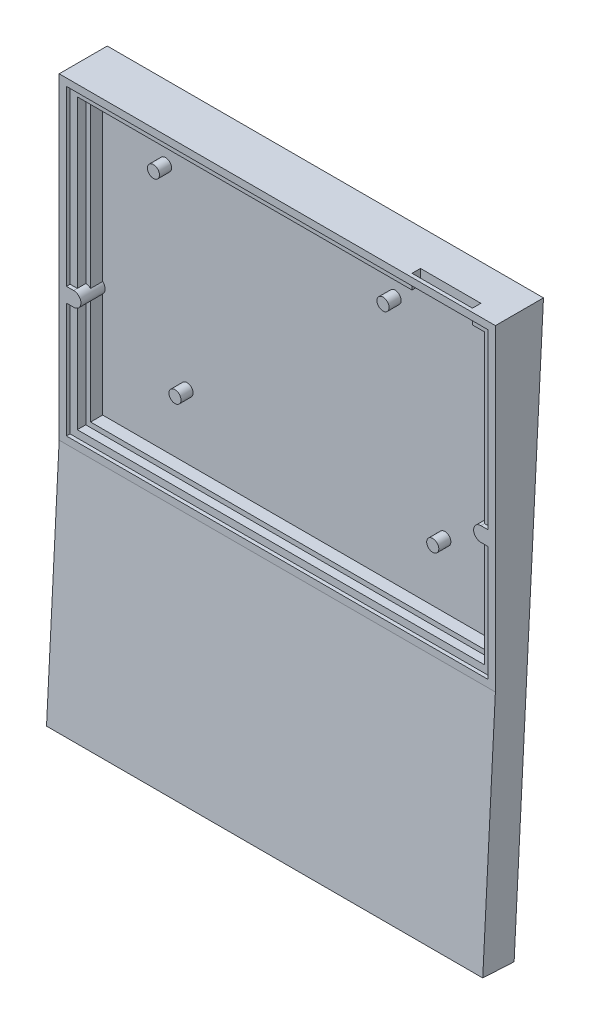
from build123d import *

# Parameters (mm, degrees)
EXTRUDE_3_DEPTH     = 8.5
EXTRUDE_3_2_DEPTH   = 8.5
SKETCH_4_W          = 180.5019154
SKETCH_4_H          = 131.300307
EXTRUDE_5_DEPTH     = 10
EXTRUDE_6_DEPTH     = 5
SKETCH_8_W          = 25
SKETCH_8_H          = 6
CUT_EXTRUDE_1_DEPTH = 3.5
SKETCH_9_R          = 2.5
EXTRUDE_7_DEPTH     = 5
EXTRUDE_7_2_DEPTH   = 5
EXTRUDE_7_3_DEPTH   = 5
EXTRUDE_7_4_DEPTH   = 5
EXTRUDE_8_DEPTH     = 180.5019154


with BuildPart() as part:
    # Model → 凸台-拉伸3 (new body)
    with BuildSketch(Plane.XY):
        Polygon((565.397621393, -28.479593633), (562.397621393, -28.479593633), (562.397621393, -73.105300633), (393.895705993, -73.105300633), (393.895705993, -28.478893633), (390.895705993, -28.478893633), (390.895705993, -76.105300633), (565.397621393, -76.105300633), align=None)
    extrude(amount=EXTRUDE_3_DEPTH)



with BuildPart() as body_2:
    # Model → Extrude 3 2 (new body)
    with BuildSketch(Plane.XY):
        Polygon((393.895705993, -22.478893633), (393.895705993, 46.195006367), (562.397621393, 46.195006367), (562.397621393, -22.479593633), (565.397621393, -22.479593633), (565.397621393, 49.195006367), (390.895705993, 49.195006367), (390.895705993, -22.478893633), align=None)
    extrude(amount=EXTRUDE_3_2_DEPTH)


with BuildPart() as part_1:
    add(part.part)

    add(body_2.part)  # 凸台-拉伸5 merges body 2
    # 草图4 → 凸台-拉伸5 (add)
    with BuildSketch(Plane(origin=(0, 0, 0), x_dir=(-1, 0, 0), z_dir=(0, 0, -1))):
        with Locations((-478.146663693, -13.455147133)):
            Rectangle(SKETCH_4_W, SKETCH_4_H)
        with BuildLine():
            ThreePointArc((-562.397621393, -28.479593633), (-559.397621393, -25.479593633), (-562.397621393, -22.479593633))
            Line((-562.397621393, -22.479593633), (-565.397621393, -22.479593633))
            Line((-565.397621393, -22.479593633), (-565.397621393, 49.195006367))
            Line((-565.397621393, 49.195006367), (-390.895705993, 49.195006367))
            Line((-390.895705993, 49.195006367), (-390.895705993, -22.478893633))
            Line((-390.895705993, -22.478893633), (-393.895705993, -22.478893633))
            ThreePointArc((-393.895705993, -22.478893633), (-396.895705993, -25.478893633), (-393.895705993, -28.478893633))
            Line((-393.895705993, -28.478893633), (-390.895705993, -28.478893633))
            Line((-390.895705993, -28.478893633), (-390.895705993, -76.105300633))
            Line((-390.895705993, -76.105300633), (-565.397621393, -76.105300633))
            Line((-565.397621393, -76.105300633), (-565.397621393, -28.479593633))
            Line((-565.397621393, -28.479593633), (-562.397621393, -28.479593633))
        make_face(mode=Mode.SUBTRACT)
    extrude(amount=-EXTRUDE_5_DEPTH)

    # 草图5 → 凸台-拉伸6 (add)
    with BuildSketch(Plane(origin=(0, 0, 0), x_dir=(-1, 0, 0), z_dir=(0, 0, -1))):
        with BuildLine():
            Line((-562.397621393, 46.195006367), (-562.397621393, -22.479593633))
            ThreePointArc((-562.397621393, -22.479593633), (-561.327155124, -22.677076556), (-560.397621393, -23.243525656))
            Line((-560.397621393, -23.243525656), (-560.397621393, 44.195006367))
            Line((-560.397621393, 44.195006367), (-395.895705993, 44.195006367))
            Line((-395.895705993, 44.195006367), (-395.895705993, -23.242825656))
            ThreePointArc((-395.895705993, -23.242825656), (-394.966172262, -22.676376556), (-393.895705993, -22.478893633))
            Line((-393.895705993, -22.478893633), (-393.895705993, 46.195006367))
            Line((-393.895705993, 46.195006367), (-562.397621393, 46.195006367))
        make_face()
        with BuildLine():
            Line((-560.397621393, -71.105300633), (-560.397621393, -27.715661611))
            ThreePointArc((-560.397621393, -27.715661611), (-561.327155124, -28.28211071), (-562.397621393, -28.479593633))
            Line((-562.397621393, -28.479593633), (-562.397621393, -73.105300633))
            Line((-562.397621393, -73.105300633), (-393.895705993, -73.105300633))
            Line((-393.895705993, -73.105300633), (-393.895705993, -28.478893633))
            ThreePointArc((-393.895705993, -28.478893633), (-394.966172262, -28.28141071), (-395.895705993, -27.714961611))
            Line((-395.895705993, -27.714961611), (-395.895705993, -71.105300633))
            Line((-395.895705993, -71.105300633), (-560.397621393, -71.105300633))
        make_face()
    extrude(amount=-EXTRUDE_6_DEPTH)

    # 草图8 → 切除-拉伸1 (cut)
    with BuildSketch(Plane.XY.offset(5)):
        with Locations((544.897621393, 49.195006367)):
            Rectangle(SKETCH_8_W, SKETCH_8_H)
    extrude(amount=CUT_EXTRUDE_1_DEPTH, mode=Mode.SUBTRACT)



with BuildPart() as body_2_2:
    # 草图9 → 凸台-拉伸7 (new body)
    with BuildSketch(Plane(origin=(0, 0, 0), x_dir=(-1, 0, 0), z_dir=(0, 0, -1))):
        with Locations((-430.805705993, -44.525300633)):
            Circle(SKETCH_9_R)
    extrude(amount=-EXTRUDE_7_DEPTH)


with BuildPart() as body_3:
    # 草图9 → Extrude 7 2 (new body)
    with BuildSketch(Plane(origin=(0, 0, 0), x_dir=(-1, 0, 0), z_dir=(0, 0, -1))):
        with Locations((-537.477621393, -44.525300633)):
            Circle(SKETCH_9_R)
    extrude(amount=-EXTRUDE_7_2_DEPTH)


with BuildPart() as body_4:
    # 草图9 → Extrude 7 3 (new body)
    with BuildSketch(Plane(origin=(0, 0, 0), x_dir=(-1, 0, 0), z_dir=(0, 0, -1))):
        with Locations((-421.895705993, 31.665006367)):
            Circle(SKETCH_9_R)
    extrude(amount=-EXTRUDE_7_3_DEPTH)


with BuildPart() as body_5:
    # 草图9 → Extrude 7 4 (new body)
    with BuildSketch(Plane(origin=(0, 0, 0), x_dir=(-1, 0, 0), z_dir=(0, 0, -1))):
        with Locations((-516.895705993, 31.665006367)):
            Circle(SKETCH_9_R)
    extrude(amount=-EXTRUDE_7_4_DEPTH)


with BuildPart() as part_2:
    add(part_1.part)

    add(body_2_2.part)  # 凸台-拉伸8 merges body 2 2

    add(body_3.part)  # 凸台-拉伸8 merges body 3

    add(body_4.part)  # 凸台-拉伸8 merges body 4

    add(body_5.part)  # 凸台-拉伸8 merges body 5
    # 草图10 → 凸台-拉伸8 (add)
    with BuildSketch(Plane.ZY.offset(-387.895705993)):
        Polygon((2.251411672, -179.64862154), (-9.898998007, 52.195006367), (0, 52.195006367), (0, -79.105300633), (10, -79.105300633), (15.233595624, -178.968254109), align=None)
    extrude(amount=-EXTRUDE_8_DEPTH)


solid = part_2.part
